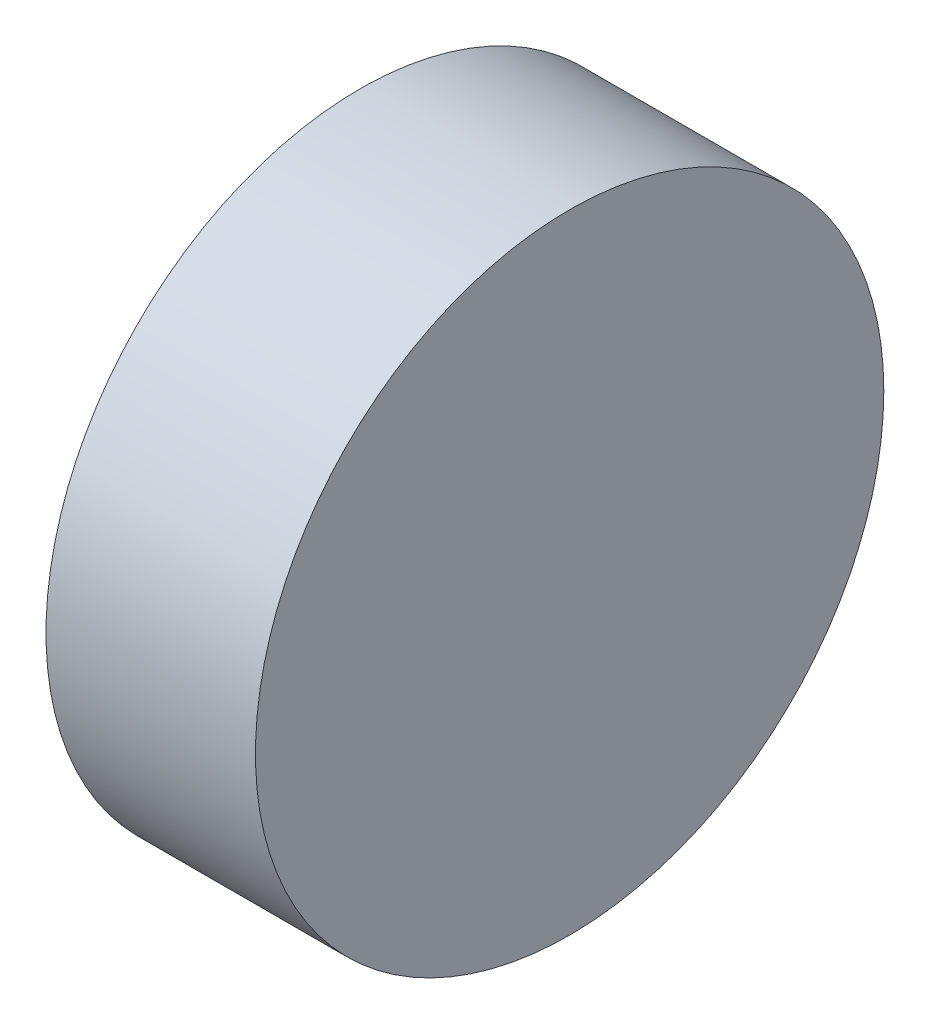
from build123d import *

# Parameters (mm, degrees)
SKETCH1_R           = 30
SKETCH1_R_2         = 2.5
BOSS_EXTRUDE1_DEPTH = 10
SKETCH2_R           = 30
BOSS_EXTRUDE2_DEPTH = 10


with BuildPart() as part:
    # Sketch1 → Boss-Extrude1 (new body)
    with BuildSketch(Plane(origin=(0, 0, 0), x_dir=(0, 0, -1), z_dir=(1, 0, 0))):
        Circle(SKETCH1_R)
        Circle(SKETCH1_R_2, mode=Mode.SUBTRACT)
    extrude(amount=BOSS_EXTRUDE1_DEPTH)

    # Sketch2 → Boss-Extrude2 (add)
    with BuildSketch(Plane(origin=(10, 0, 0), x_dir=(0, 0, -1), z_dir=(1, 0, 0))):
        Circle(SKETCH2_R)
    extrude(amount=BOSS_EXTRUDE2_DEPTH)


solid = part.part
